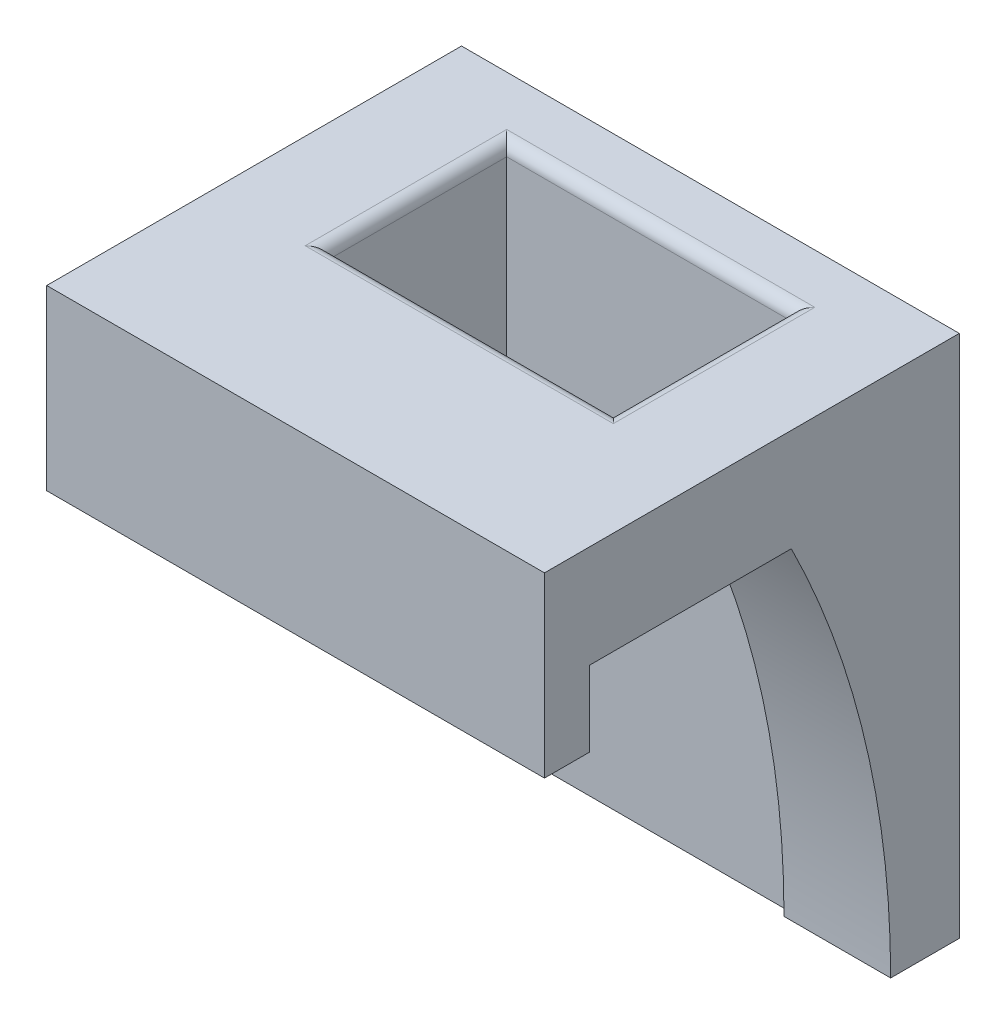
from build123d import *

# Parameters (mm, degrees)
BOSS_EXTRUDE1_DEPTH = 21
SKETCH3_W           = 24
SKETCH3_H           = 15
CUT_EXTRUDE1_DEPTH  = 59.037403457
FILLET1_R           = 1


with BuildPart() as part:
    # Sketch2 → Boss-Extrude1 (new, symmetric)
    with BuildSketch(Plane(origin=(0, 0, 0), x_dir=(0, 0, -1), z_dir=(1, 0, 0))):
        with BuildLine():
            Line((0, 0), (0, -6.35))
            Line((0, -6.35), (-3.81, -6.35))
            Line((-3.81, -6.35), (-3.81, 8.65))
            Line((-3.81, 8.65), (31.19, 8.65))
            Line((31.19, 8.65), (31.19, -35.56))
            Line((31.19, -35.56), (25.4, -35.56))
            ThreePointArc((25.4, -35.56), (23.276174446, -17.292737452), (17.018, 0))
            Line((17.018, 0), (0, 0))
        make_face()
    extrude(amount=BOSS_EXTRUDE1_DEPTH, both=True)

    # Sketch3 → Cut-Extrude1 (cut, through all)
    with BuildSketch(Plane(origin=(0, 8.65, 0), x_dir=(1, 0, 0), z_dir=(0, 1, 0))):
        with Locations((0, 18.5)):
            Rectangle(SKETCH3_W, SKETCH3_H)
    extrude(amount=-CUT_EXTRUDE1_DEPTH, mode=Mode.SUBTRACT)

    # Fillet1
    fillet1_edges = [part.edges().sort_by_distance(p)[0] for p in [
        (-12, 8.65, -18.5),
        (0, 8.65, -11),
        (12, 8.65, -18.5),
        (0, 8.65, -26),
    ]]
    fillet(fillet1_edges, radius=FILLET1_R)


solid = part.part
